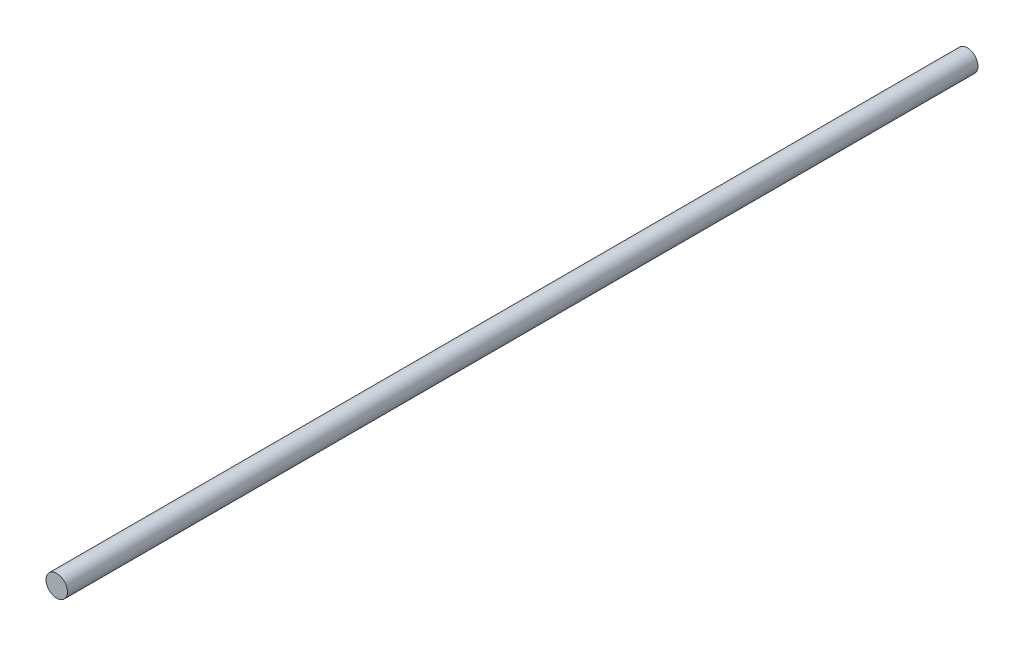
from build123d import *

# Parameters (mm, degrees)
SKETCH1_R           = 3.175
BOSS_EXTRUDE1_DEPTH = 269


with BuildPart() as part:
    # Sketch1 → Boss-Extrude1 (new body)
    with BuildSketch(Plane.XY):
        Circle(SKETCH1_R)
    extrude(amount=BOSS_EXTRUDE1_DEPTH)


solid = part.part
